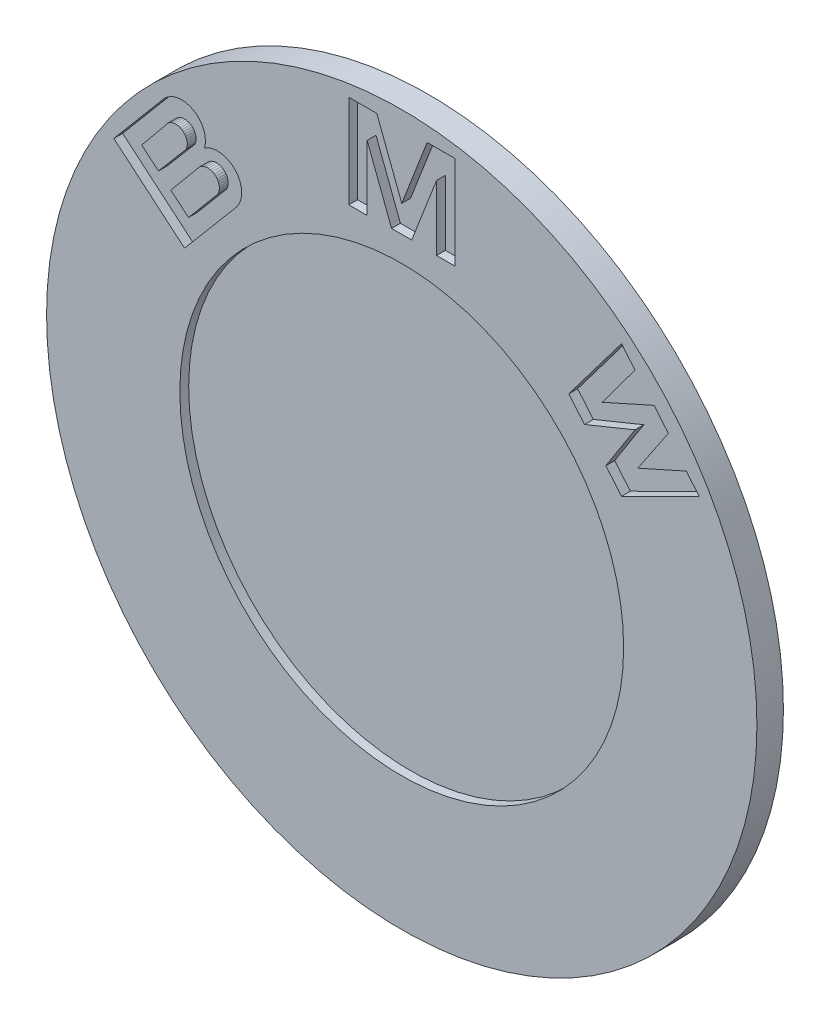
from build123d import *

# Parameters (mm, degrees)
SKETCH_1_R          = 40.2
EXTRUDE_1_DEPTH     = 3
CUT_EXTRUDE_2_DEPTH = 1
CUT_EXTRUDE_START   = -3
SKETCH_2_R          = 25.115
CUT_EXTRUDE_1_DEPTH = 1


with BuildPart() as part:
    # 草图1 → 凸台-拉伸1 (new body)
    with BuildSketch(Plane.XY):
        Circle(SKETCH_1_R)
    extrude(amount=EXTRUDE_1_DEPTH)

    # 草图4 → 切除-拉伸2 (cut)
    # profile 1 of 3: a face of its own
    with BuildSketch(Plane.XY.offset(3)):
        Polygon((-32.5857633, 21.06745862), (-24.581820031, 14.318573463), (-18.667207086, 21.333098879), (-18.41413244, 21.736159792), (-18.234803522, 22.177001467), (-18.13465246, 22.642257204), (-18.116731012, 23.117843142), (-18.181557978, 23.589339724), (-18.32718786, 24.042434206), (-18.549203241, 24.463393679), (-18.840867365, 24.839477053), (-19.193337763, 25.159270754), (-19.595940912, 25.413070192), (-20.036454523, 25.593200197), (-20.501542414, 25.694198122), (-20.977090204, 25.712981691), (-21.448693598, 25.649001589), (-21.902055109, 25.504195681), (-22.323418939, 25.282943239), (-22.237939203, 25.721435061), (-22.226228083, 26.168029299), (-22.288621271, 26.610396853), (-22.423394525, 27.03633069), (-22.626817072, 27.434081545), (-22.893288935, 27.792647829), (-23.215455377, 28.102157106), (-23.584405268, 28.354064455), (-23.989976251, 28.541396608), (-24.420968378, 28.659011354), (-24.865479792, 28.703643312), (-25.311242426, 28.67405652), (-25.745965326, 28.571090212), (-26.157632196, 28.397567263), (-26.534890497, 28.158278933), (-26.867333734, 27.859832277), align=None)
        Polygon((-29.433129633, 22.00672864), (-27.536842846, 20.401686478), (-24.415383661, 24.089553347), (-24.332948053, 24.288070192), (-24.284310663, 24.497451296), (-24.270799005, 24.71198987), (-24.292779291, 24.925811281), (-24.349656427, 25.133101931), (-24.439881647, 25.328216066), (-24.560983026, 25.505813112), (-24.709672296, 25.661040773), (-24.88187536, 25.789687624), (-25.07290777, 25.888244143), (-25.277558649, 25.953994265), (-25.490235651, 25.985183229), (-25.705155695, 25.980926027), (-25.916436518, 25.941359987), (-26.118325556, 25.867568483), (-26.305306757, 25.761535158), (-26.472298944, 25.626189699), (-26.614724481, 25.465194216), (-26.728715265, 25.282943239), align=None, mode=Mode.SUBTRACT)
        Polygon((-22.927964533, 23.086165895), (-26.131158197, 19.230041018), (-24.13251623, 17.548820009), (-20.844605768, 21.457534304), (-20.737939203, 21.661635866), (-20.668130243, 21.881103029), (-20.637284601, 22.109313479), (-20.646325434, 22.339431276), (-20.694978083, 22.564528933), (-20.781777704, 22.777846804), (-20.904122675, 22.972960939), (-21.058335626, 23.143996706), (-21.239770258, 23.285842409), (-21.442979181, 23.39419507), (-21.661851251, 23.465835085), (-21.889809931, 23.498580446), (-22.119996393, 23.491454592), (-22.345490778, 23.444686403), (-22.559518183, 23.359664431), (-22.755639398, 23.23895215), align=None, mode=Mode.SUBTRACT)
    # profile 2 of 3: a face of its own
    with BuildSketch(Plane.XY.offset(3)):
        Polygon((-5.996850336, 38.408904543), (-5.996850336, 27.859832277), (-3.91276153, 27.859832277), (-3.91276153, 35.218716958), (-1.150554499, 27.972180703), (1.12643067, 27.972180703), (3.939782293, 35.218721034), (3.939782293, 27.859832277), (6.014273321, 27.859832277), (6.014273321, 38.408905525), (2.876387274, 38.408905525), (0, 31), (-2.824097956, 38.408904543), align=None)
    # profile 3 of 3: a face of its own
    with BuildSketch(Plane.XY.offset(3)):
        Polygon((24.872824347, 29.687392702), (26.402881435, 27.859829995), (22.690074891, 22.851733117), (28.558242873, 25.479165769), (30.175307816, 23.547677324), (26.718580446, 18.404779635), (32.2027141, 20.860263506), (33.683638635, 19.091386728), (24.872830811, 14.723630109), (23.099783575, 16.841430178), (26.402884161, 22.00672864), (20.684073126, 19.667968264), (18.909277594, 21.787856569), align=None)
    extrude(amount=-CUT_EXTRUDE_2_DEPTH, mode=Mode.SUBTRACT)

    # 草图2 → 切除-拉伸1 (cut)
    with BuildSketch(Plane(origin=(0, 0, 0), x_dir=(-1, 0, 0), z_dir=(0, 0, -1)).offset(CUT_EXTRUDE_START)):
        with Locations(Location((0, 0, 0), (0, 0, 180))):
            Circle(SKETCH_2_R)
    extrude(amount=CUT_EXTRUDE_1_DEPTH, mode=Mode.SUBTRACT)


solid = part.part
